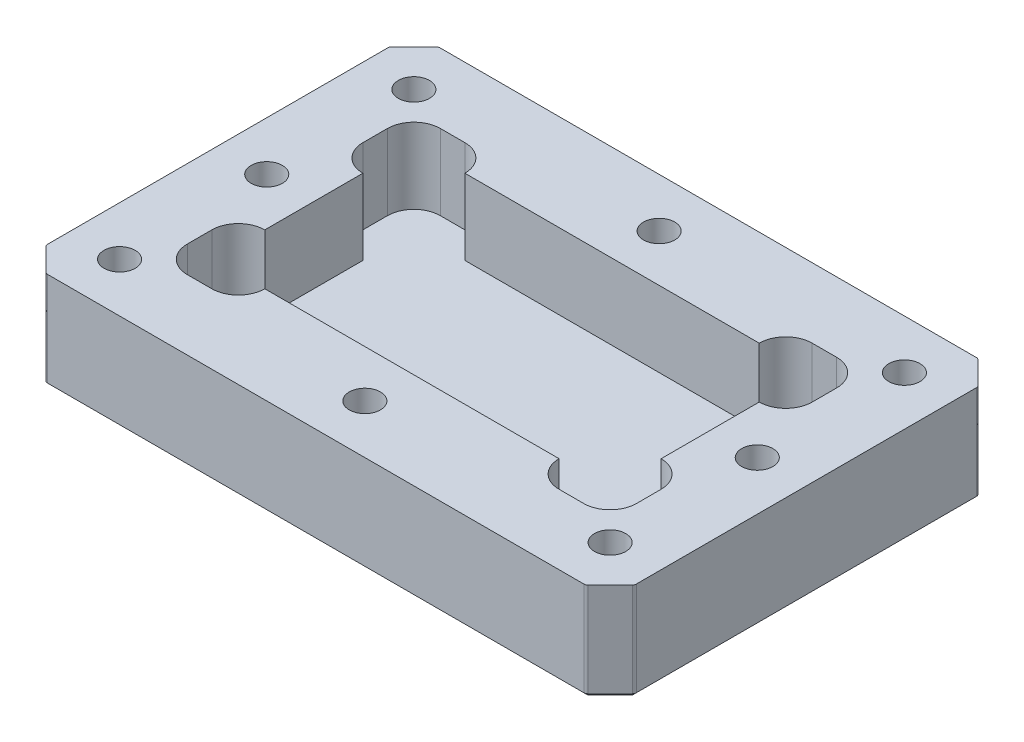
from build123d import *

# Parameters (mm, degrees)
SKETCH1_W              = 76.2
SKETCH1_H              = 50.8
BOSS_EXTRUDE1_DEPTH    = 12.7
SKETCH2_W              = 51.308
SKETCH2_H              = 25.908
CUT_EXTRUDE1_DEPTH     = 9.779
CUT_EXTRUDE2_DEPTH     = 9.779
MIRROR2_COPY_1_DEPTH   = 9.779
F_10_32_TAPPED_HOLE1_D = 4.0386
CHAMFER1_SIZE          = 3.175
FILLET1_R              = 0.508
CHAMFER2_SIZE          = 0.508
F_10_32_TAPPED_HOLE2_D = 4.0386


with BuildPart() as part:
    # Sketch1 → Boss-Extrude1 (new body)
    with BuildSketch(Plane(origin=(0, 0, 0), x_dir=(1, 0, 0), z_dir=(0, 1, 0))):
        Rectangle(SKETCH1_W, SKETCH1_H)
    extrude(amount=BOSS_EXTRUDE1_DEPTH)

    # Sketch2 → Cut-Extrude1 (cut)
    with BuildSketch(Plane(origin=(0, 12.7, 0), x_dir=(1, 0, 0), z_dir=(0, 1, 0))):
        Rectangle(SKETCH2_W, SKETCH2_H)
    extrude(amount=-CUT_EXTRUDE1_DEPTH, mode=Mode.SUBTRACT)

    # Sketch3 → Cut-Extrude2 (cut)
    with BuildSketch(Plane(origin=(0, 12.7, 0), x_dir=(1, 0, 0), z_dir=(0, 1, 0))):
        with BuildLine():
            Line((-22.479, 16.383), (-25.654, 16.383))
            ThreePointArc((-25.654, 16.383), (-28.078669153, 15.378669153), (-29.083, 12.954))
            Line((-29.083, 12.954), (-29.083, 9.779))
            ThreePointArc((-29.083, 9.779), (-26.96622149, 6.611017083), (-23.229330847, 7.354330847))
            Line((-23.229330847, 7.354330847), (-20.054330847, 10.529330847))
            ThreePointArc((-20.054330847, 10.529330847), (-19.311017083, 14.26622149), (-22.479, 16.383))
        make_face()
    cut_extrude2 = extrude(amount=-CUT_EXTRUDE2_DEPTH, mode=Mode.SUBTRACT)

    # Mirror1: Cut-Extrude2 across plane
    add(cut_extrude2.mirror(Plane.XY), mode=Mode.SUBTRACT)

    # Mirror2: Cut-Extrude2 across plane
    add(cut_extrude2.mirror(Plane(origin=(0, 0, 0), x_dir=(0, 0, 1), z_dir=(1, 0, 0))), mode=Mode.SUBTRACT)

    # Mirror2 copy 1 sketch → Mirror2 copy 1 (cut)
    with BuildSketch(Plane(origin=(0, 12.7, 0), x_dir=(-1, 0, 0), z_dir=(0, 1, 0))):
        with BuildLine():
            Line((-22.479, 16.383), (-25.654, 16.383))
            ThreePointArc((-25.654, 16.383), (-28.078669153, 15.378669153), (-29.083, 12.954))
            Line((-29.083, 12.954), (-29.083, 9.779))
            ThreePointArc((-29.083, 9.779), (-26.96622149, 6.611017083), (-23.229330847, 7.354330847))
            Line((-23.229330847, 7.354330847), (-20.054330847, 10.529330847))
            ThreePointArc((-20.054330847, 10.529330847), (-19.311017083, 14.26622149), (-22.479, 16.383))
        make_face()
    extrude(amount=-MIRROR2_COPY_1_DEPTH, mode=Mode.SUBTRACT)

    # #10-32 Tapped Hole1 (through all)
    with Locations(Plane(origin=(0, 12.7, 0), x_dir=(1, 0, 0), z_dir=(0, 1, 0))):
        with Locations((-31.75, 19.05), (31.75, 19.05), (31.75, -19.05), (-31.75, -19.05)):
            Hole(F_10_32_TAPPED_HOLE1_D / 2)

    # Chamfer1
    chamfer1_edges = [part.edges().sort_by_distance(p)[0] for p in [
        (38.1, 6.35, 25.4),
        (-38.1, 6.35, 25.4),
        (-38.1, 6.35, -25.4),
        (38.1, 6.35, -25.4),
    ]]
    chamfer(chamfer1_edges, length=CHAMFER1_SIZE)

    # Fillet1
    fillet1_edges = [part.edges().sort_by_distance(p)[0] for p in [
        (-38.1, 6.35, 22.225),
        (-38.1, 6.35, -22.225),
        (34.925, 6.35, -25.4),
        (-34.925, 6.35, -25.4),
        (38.1, 6.35, 22.225),
        (38.1, 6.35, -22.225),
        (-34.925, 6.35, 25.4),
        (34.925, 6.35, 25.4),
    ]]
    fillet(fillet1_edges, radius=FILLET1_R)

    # Chamfer2
    chamfer2_edges = [part.edges().sort_by_distance(p)[0] for p in [
        (38.1, 0, 0),
        (36.5125, 0, -23.8125),
        (-38.1, 0, 0),
        (-36.5125, 0, -23.8125),
        (0, 0, -25.4),
        (36.5125, 0, 23.8125),
        (0, 0, 25.4),
        (-36.5125, 0, 23.8125),
        (34.908982694, 0, 25.361330803),
        (38.061330803, 0, 22.208982694),
        (-38.061330803, 0, 22.208982694),
        (-34.908982694, 0, 25.361330803),
        (-38.061330803, 0, -22.208982694),
        (-34.908982694, 0, -25.361330803),
        (34.908982694, 0, -25.361330803),
        (38.061330803, 0, -22.208982694),
    ]]
    chamfer(chamfer2_edges, length=CHAMFER2_SIZE)

    # #10-32 Tapped Hole2 (through all)
    with Locations(Plane(origin=(0, 0, 0), x_dir=(-1, 0, 0), z_dir=(0, -1, 0))):
        with Locations((0, 19.05), (0, -19.05), (31.75, 0), (-31.75, 0)):
            Hole(F_10_32_TAPPED_HOLE2_D / 2)


solid = part.part
